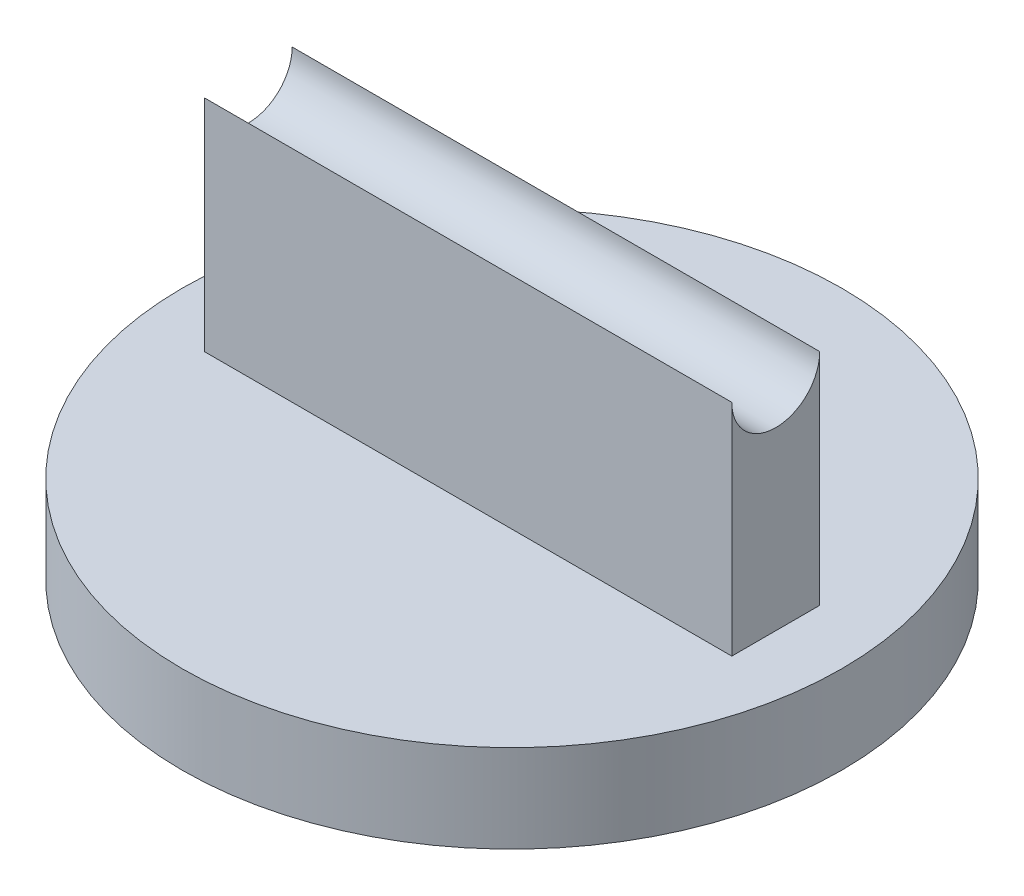
from build123d import *

# Parameters (mm, degrees)
SKIZZE1_R                       = 75
AUFSATZ_LINEAR_AUSTRAGEN1_DEPTH = 20
SKIZZE2_W                       = 120
SKIZZE2_H                       = 20
AUFSATZ_LINEAR_AUSTRAGEN2_DEPTH = 50
SKIZZE4_R                       = 10
SCHNITT_LINEAR_AUSTRAGEN2_DEPTH = 122


with BuildPart() as part:
    # Skizze1 → Aufsatz-Linear austragen1 (new body)
    with BuildSketch(Plane(origin=(0, 0, 0), x_dir=(1, 0, 0), z_dir=(0, 1, 0))):
        with Locations(Location((0, 0, 0), (0, 0, 270))):
            Circle(SKIZZE1_R)
    extrude(amount=AUFSATZ_LINEAR_AUSTRAGEN1_DEPTH)

    # Skizze2 → Aufsatz-Linear austragen2 (add)
    with BuildSketch(Plane(origin=(0, 20, 0), x_dir=(1, 0, 0), z_dir=(0, 1, 0))):
        Rectangle(SKIZZE2_W, SKIZZE2_H)
    extrude(amount=AUFSATZ_LINEAR_AUSTRAGEN2_DEPTH)

    # Skizze4 → Schnitt-Linear austragen2 (cut)
    with BuildSketch(Plane.ZY.offset(60)):
        with Locations((0, 70)):
            Circle(SKIZZE4_R)
    extrude(amount=-SCHNITT_LINEAR_AUSTRAGEN2_DEPTH, mode=Mode.SUBTRACT)


solid = part.part
